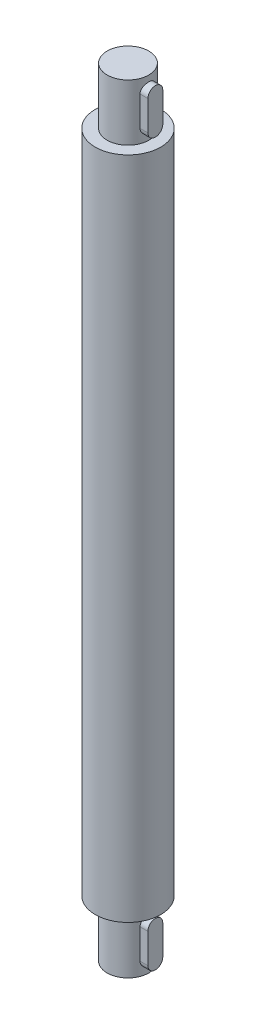
from build123d import *

# Parameters (mm, degrees)
SKETCH1_R           = 7
BOSS_EXTRUDE1_DEPTH = 19
SKETCH2_R           = 11
BOSS_EXTRUDE2_DEPTH = 223.5
SKETCH3_R           = 7
BOSS_EXTRUDE3_DEPTH = 19
BOSS_EXTRUDE4_START = -3
BOSS_EXTRUDE4_DEPTH = 5.2


with BuildPart() as part:
    # Sketch1 → Boss-Extrude1 (new body)
    with BuildSketch(Plane(origin=(0, 0, 0), x_dir=(1, 0, 0), z_dir=(0, 1, 0))):
        Circle(SKETCH1_R)
    extrude(amount=BOSS_EXTRUDE1_DEPTH)

    # Sketch2 → Boss-Extrude2 (add)
    with BuildSketch(Plane(origin=(0, 19, 0), x_dir=(1, 0, 0), z_dir=(0, 1, 0))):
        Circle(SKETCH2_R)
    extrude(amount=BOSS_EXTRUDE2_DEPTH)

    # Sketch3 → Boss-Extrude3 (add)
    with BuildSketch(Plane(origin=(0, 242.5, 0), x_dir=(1, 0, 0), z_dir=(0, 1, 0))):
        Circle(SKETCH3_R)
    extrude(amount=BOSS_EXTRUDE3_DEPTH)

    # Sketch4 → Boss-Extrude4 (add)
    with BuildSketch(Plane(origin=(7, 0, 0), x_dir=(0, 0, -1), z_dir=(1, 0, 0)).offset(BOSS_EXTRUDE4_START)):
        with BuildLine():
            Line((-2.5, 4.5), (-2.5, 14.5))
            ThreePointArc((-2.5, 14.5), (0, 17), (2.5, 14.5))
            Line((2.5, 14.5), (2.5, 4.5))
            ThreePointArc((2.5, 4.5), (0, 2), (-2.5, 4.5))
        make_face()
    boss_extrude4 = extrude(amount=BOSS_EXTRUDE4_DEPTH)

    # Mirror1: Boss-Extrude4 across plane
    add(boss_extrude4.mirror(Plane.ZX.offset(130.75)))


solid = part.part
